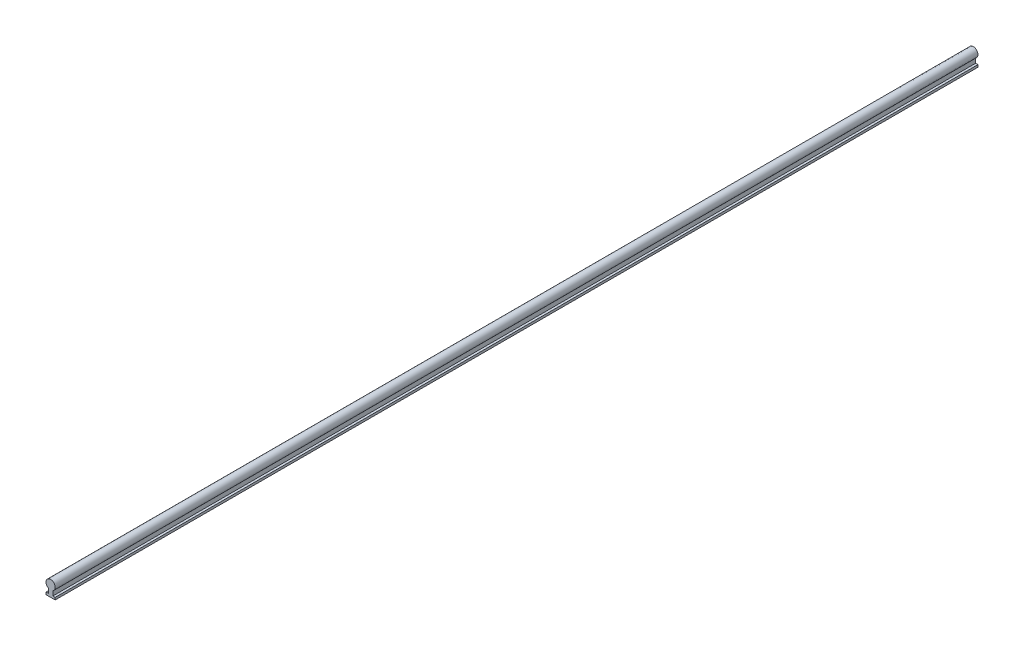
from build123d import *

# Parameters (mm, degrees)
BOSS_EXTRUDE1_DEPTH = 1000


with BuildPart() as part:
    # Sketch2 → Boss-Extrude1 (new body)
    with BuildSketch(Plane.XY):
        with BuildLine():
            Line((-5, -5), (5, -5))
            Line((5, -5), (5, -2.5))
            Line((5, -2.5), (2.5, -2.5))
            Line((2.5, -2.5), (2.5, 2.5))
            ThreePointArc((2.5, 2.5), (0, 11.830127019), (-2.5, 2.5))
            Line((-2.5, 2.5), (-2.5, -2.5))
            Line((-2.5, -2.5), (-5, -2.5))
            Line((-5, -2.5), (-5, -5))
        make_face()
    extrude(amount=BOSS_EXTRUDE1_DEPTH)


solid = part.part
